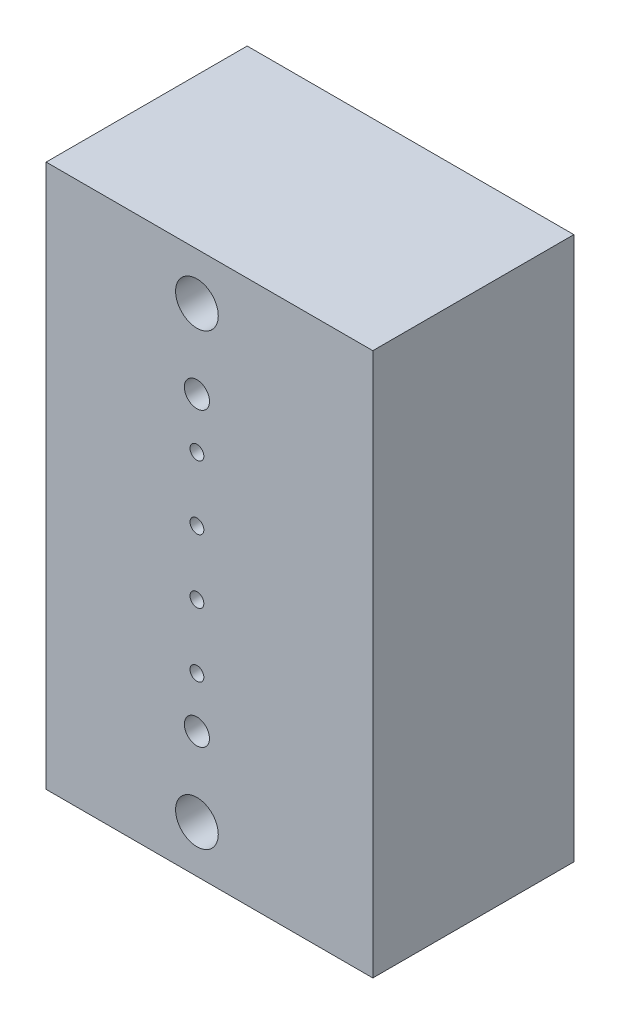
from build123d import *

# Parameters (mm, degrees)
SKETCH1_W               = 26
SKETCH1_H               = 43.24
BOSS_EXTRUDE1_DEPTH     = 16
CUT_EXTRUDE1_DEPTH      = 39.06079873
CUT_EXTRUDE1_DEPTH_BACK = 39.06079873
SKETCH2_R               = 0.55
SKETCH2_R_2             = 1.7
SKETCH3_W               = 14.5
SKETCH3_H               = 20.24
CUT_EXTRUDE3_DEPTH      = 4
SKETCH4_R               = 1
CUT_EXTRUDE5_DEPTH      = 10


with BuildPart() as part:
    # Sketch1 → Boss-Extrude1 (new body)
    with BuildSketch(Plane.XY):
        with Locations((9, 5)):
            Rectangle(SKETCH1_W, SKETCH1_H)
    extrude(amount=BOSS_EXTRUDE1_DEPTH)

    # Sketch2 → Cut-Extrude1 (cut, two sides: drawn at the far end of the back side and taken through both)
    with BuildSketch(Plane.XY.offset(-CUT_EXTRUDE1_DEPTH_BACK)):
        with Locations((8, -2.62)):
            Circle(SKETCH2_R)
        with Locations((8, 2.46)):
            Circle(SKETCH2_R)
        with Locations((8, 7.54)):
            Circle(SKETCH2_R)
        with Locations((8, 12.62)):
            Circle(SKETCH2_R)
        with Locations((8, -12.87)):
            Circle(SKETCH2_R_2)
        with Locations((8, 22.87)):
            Circle(SKETCH2_R_2)
    extrude(amount=CUT_EXTRUDE1_DEPTH + CUT_EXTRUDE1_DEPTH_BACK, mode=Mode.SUBTRACT)

    # Sketch3 → Cut-Extrude3 (cut)
    with BuildSketch(Plane.XY):
        with Locations((3.25, 5)):
            Rectangle(SKETCH3_W, SKETCH3_H)
    extrude(amount=CUT_EXTRUDE3_DEPTH, mode=Mode.SUBTRACT)

    # Sketch4 → Cut-Extrude5 (cut)
    with BuildSketch(Plane.XY.offset(16)):
        with Locations((8, -6.62)):
            Circle(SKETCH4_R)
        with Locations((8, 16.62)):
            Circle(SKETCH4_R)
    extrude(amount=-CUT_EXTRUDE5_DEPTH, mode=Mode.SUBTRACT)


solid = part.part
